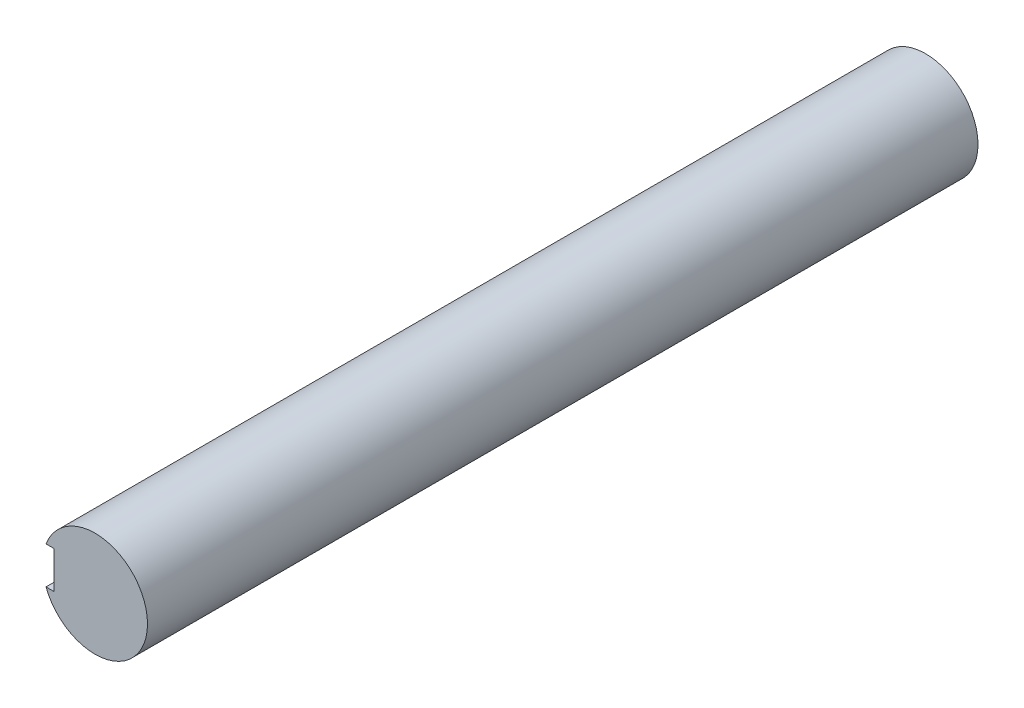
from build123d import *

# Parameters (mm, degrees)
BOSS_EXTRUDE1_DEPTH      = 85
BOSS_EXTRUDE1_DEPTH_BACK = 10
SKETCH1_R                = 6
SKETCH2_W                = 2.203214475
SKETCH2_H                = 4.25945658
CUT_EXTRUDE1_DEPTH       = 80


with BuildPart() as part:
    # Sketch1 → Boss-Extrude1 (new, two sides: drawn at the far end of the back side and taken through both)
    with BuildSketch(Plane.XY.offset(-BOSS_EXTRUDE1_DEPTH_BACK)):
        with Locations((-78.64751379, -368.822211525)):
            Circle(SKETCH1_R)
    extrude(amount=BOSS_EXTRUDE1_DEPTH + BOSS_EXTRUDE1_DEPTH_BACK)

    # Sketch2 → Cut-Extrude1 (cut)
    with BuildSketch(Plane.XY.offset(85)):
        with Locations((-84.444038678, -368.822211525)):
            Rectangle(SKETCH2_W, SKETCH2_H)
    extrude(amount=-CUT_EXTRUDE1_DEPTH, mode=Mode.SUBTRACT)


solid = part.part
